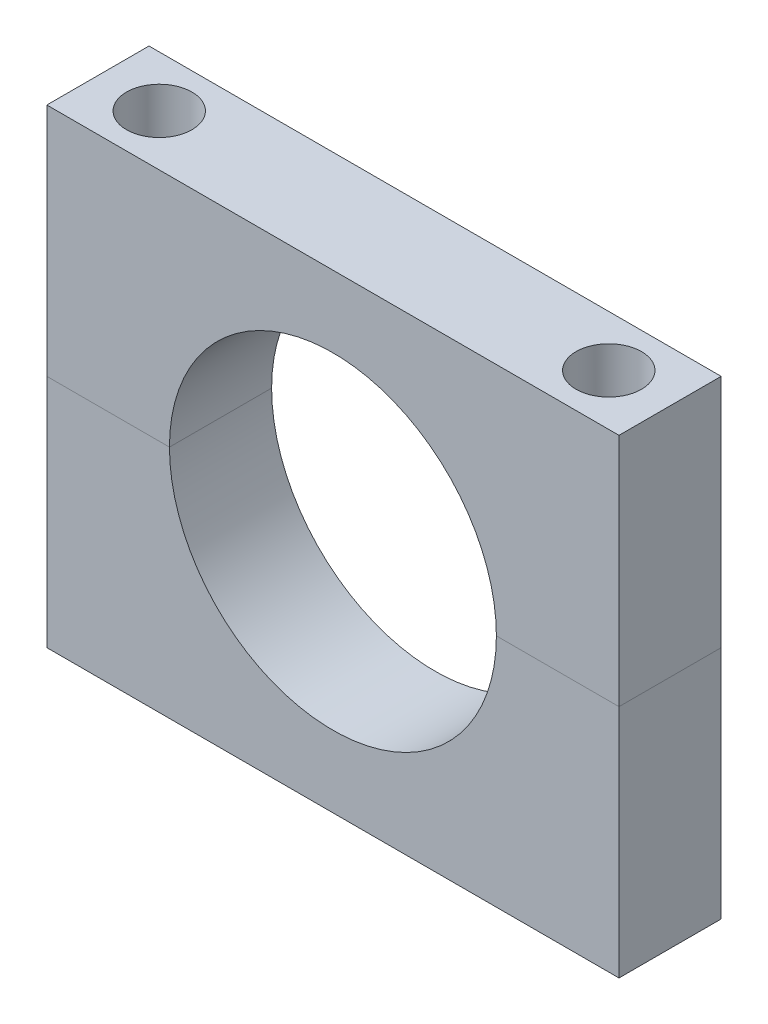
from build123d import *

# Parameters (mm, degrees)
SKETCH_1_W          = 28
SKETCH_1_H          = 23
SKETCH_1_R          = 8
EXTRUDE_1_DEPTH     = 5
SKETCH_2_R          = 1.6
CUT_EXTRUDE_1_DEPTH = 28.386127875


with BuildPart() as part:
    # 草图1 → 凸台-拉伸1 (new body)
    with BuildSketch(Plane.XY):
        Rectangle(SKETCH_1_W, SKETCH_1_H)
        Circle(SKETCH_1_R, mode=Mode.SUBTRACT)
    extrude(amount=EXTRUDE_1_DEPTH)

    # 草图2 → 切除-拉伸1 (cut, through all)
    with BuildSketch(Plane(origin=(0, 11.5, 0), x_dir=(1, 0, 0), z_dir=(0, 1, 0))):
        with Locations(Location((-11, -2.5, 0), (0, 0, 270))):
            Circle(SKETCH_2_R)
        with Locations(Location((11, -2.5, 0), (0, 0, 90))):
            Circle(SKETCH_2_R)
    extrude(amount=-CUT_EXTRUDE_1_DEPTH, mode=Mode.SUBTRACT)


with BuildPart() as body_2:
    # Split Bodies 1: the piece on the far side of the plane
    add(part.part)
    split(bisect_by=Plane.ZX, keep=Keep.BOTTOM)


with BuildPart() as part_1:
    add(part.part)

    # Split Bodies 1
    split(bisect_by=Plane.ZX, keep=Keep.TOP)


solid = Compound([body_2.part, part_1.part])
